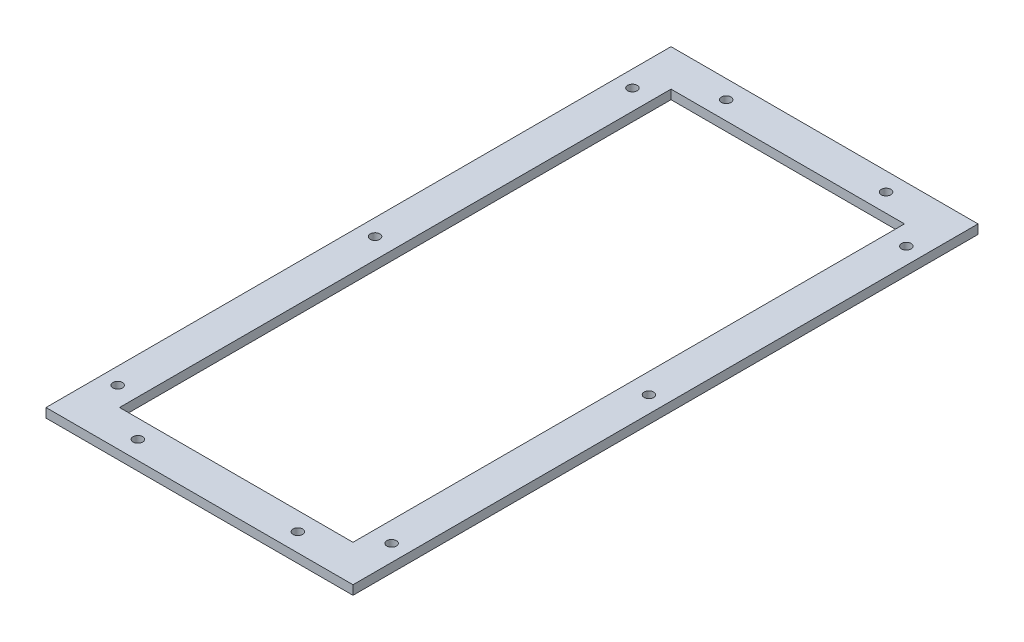
from build123d import *

# Parameters (mm, degrees)
CROQUIS1_W              = 167
CROQUIS1_H              = 340
CROQUIS1_R              = 2.6
SALIENTE_EXTRUIR1_DEPTH = 5
SKETCH1_W               = 127
SKETCH1_H               = 300
CUT_EXTRUDE1_DEPTH      = 10


with BuildPart() as part:
    # Croquis1 → Saliente-Extruir1 (new body)
    with BuildSketch(Plane(origin=(0, 0, 0), x_dir=(1, 0, 0), z_dir=(0, 1, 0))):
        Rectangle(CROQUIS1_W, CROQUIS1_H)
        with Locations(Location((-74.5, 140, 0), (0, 0, 270))):
            Circle(CROQUIS1_R, mode=Mode.SUBTRACT)
        with Locations(Location((-74.5, 0, 0), (0, 0, 270))):
            Circle(CROQUIS1_R, mode=Mode.SUBTRACT)
        with Locations(Location((-74.5, -140, 0), (0, 0, 270))):
            Circle(CROQUIS1_R, mode=Mode.SUBTRACT)
        with Locations(Location((74.5, 140, 0), (0, 0, 270))):
            Circle(CROQUIS1_R, mode=Mode.SUBTRACT)
        with Locations(Location((74.5, -140, 0), (0, 0, 270))):
            Circle(CROQUIS1_R, mode=Mode.SUBTRACT)
        with Locations(Location((74.5, 0, 0), (0, 0, 270))):
            Circle(CROQUIS1_R, mode=Mode.SUBTRACT)
        with Locations(Location((-43.5, 160, 0), (0, 0, 270))):
            Circle(CROQUIS1_R, mode=Mode.SUBTRACT)
        with Locations(Location((43.5, 160, 0), (0, 0, 270))):
            Circle(CROQUIS1_R, mode=Mode.SUBTRACT)
        with Locations(Location((-43.5, -160, 0), (0, 0, 270))):
            Circle(CROQUIS1_R, mode=Mode.SUBTRACT)
        with Locations(Location((43.5, -160, 0), (0, 0, 270))):
            Circle(CROQUIS1_R, mode=Mode.SUBTRACT)
    extrude(amount=SALIENTE_EXTRUIR1_DEPTH)

    # Sketch1 → Cut-Extrude1 (cut)
    with BuildSketch(Plane(origin=(0, 5, 0), x_dir=(1, 0, 0), z_dir=(0, 1, 0))):
        Rectangle(SKETCH1_W, SKETCH1_H)
    extrude(amount=-CUT_EXTRUDE1_DEPTH, mode=Mode.SUBTRACT)


solid = part.part
